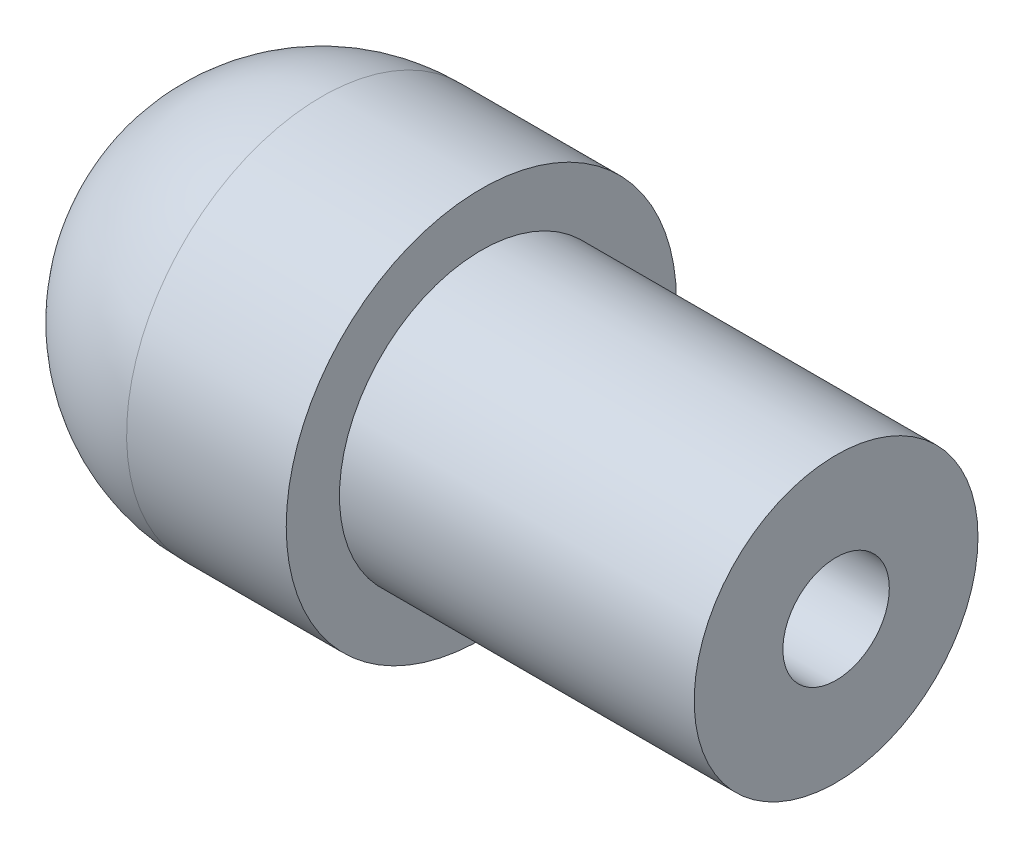
from build123d import *

# Parameters (mm, degrees)
SKETCH4_R          = 1.5
CUT_EXTRUDE1_DEPTH = 14.5


with BuildPart() as part:
    # Sketch3 → Revolve1 (revolve)
    with BuildSketch(Plane.XY, mode=Mode.PRIVATE) as revolve1_sk:
        with BuildLine():
            Line((5.5, 5.5), (10, 5.5))
            Line((10, 5.5), (10, 4))
            Line((10, 4), (20, 4))
            Line((20, 4), (20, 0))
            Line((20, 0), (0, 0))
            ThreePointArc((0, 0), (1.610912703, 3.889087297), (5.5, 5.5))
        make_face()
    revolve(revolve1_sk.sketch.rotate(Axis((0, 0, 0), (-1, 0, 0)), 90), axis=Axis((0, 0, 0), (-1, 0, 0)))

    # Sketch4 → Cut-Extrude1 (cut)
    with BuildSketch(Plane(origin=(20, 0, 0), x_dir=(0, 0, -1), z_dir=(1, 0, 0))):
        Circle(SKETCH4_R)
    extrude(amount=-CUT_EXTRUDE1_DEPTH, mode=Mode.SUBTRACT)


solid = part.part
